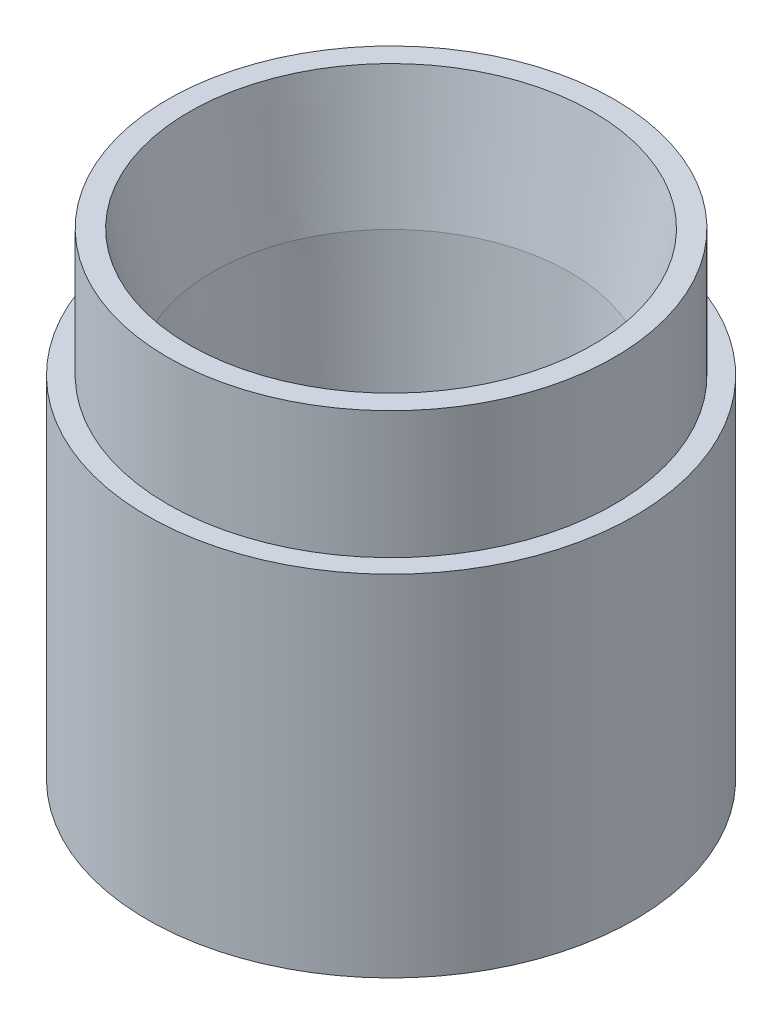
from build123d import *


with BuildPart() as part:
    # Sketch1 → Revolve1 (revolve)
    with BuildSketch(Plane.XY, mode=Mode.PRIVATE) as revolve1_sk:
        Polygon((-55.88, 0), (-63.1204351, 39.7879841), (-69.85, 39.7879841), (-69.85, 0), (-76.2, 0), (-76.2, -109.340308374), (-49.53, -109.340308374), (-49.53, -90.290308374), align=None)
    revolve(revolve1_sk.sketch.rotate(Axis((0, -117.749222998, 0), (0, 1, 0)), 270), axis=Axis((0, -117.749222998, 0), (0, 1, 0)))


solid = part.part
